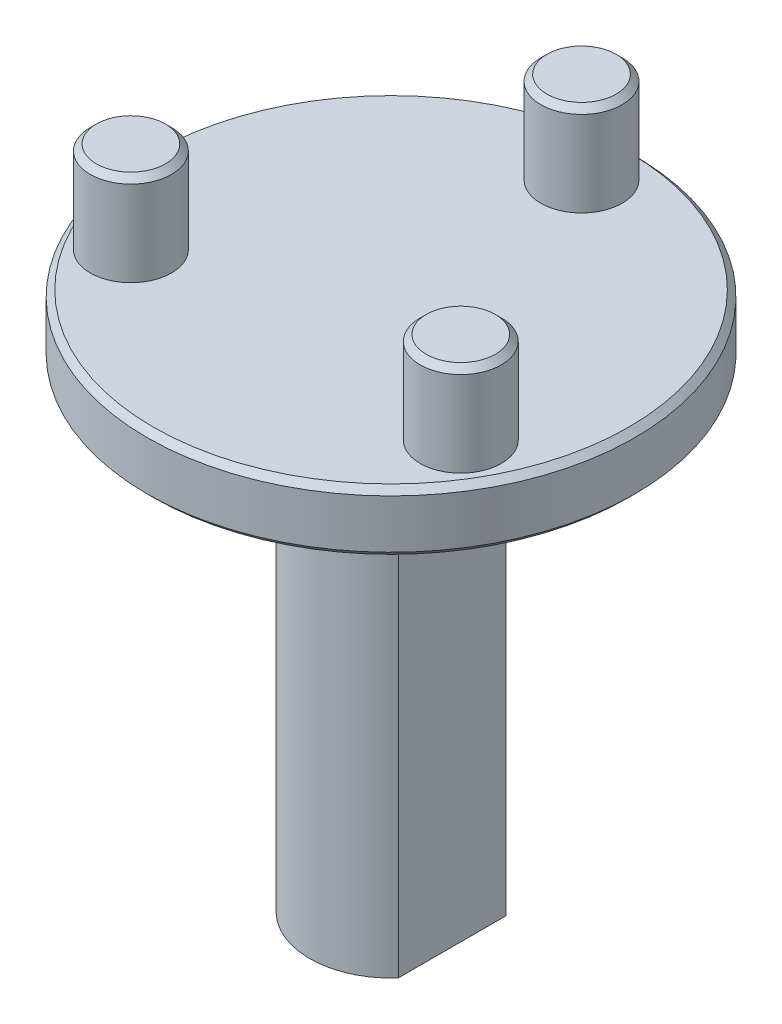
from build123d import *

# Parameters (mm, degrees)
SKETCH1_R           = 12
BOSS_EXTRUDE1_DEPTH = 3
SKETCH2_R           = 2
BOSS_EXTRUDE2_DEPTH = 4.5
SKETCH3_R           = 5
BOSS_EXTRUDE3_DEPTH = 1
BOSS_EXTRUDE4_DEPTH = 22.5
CHAMFER1_SIZE       = 0.3


with BuildPart() as part:
    # Sketch1 → Boss-Extrude1 (new body)
    with BuildSketch(Plane(origin=(0, 0, 0), x_dir=(1, 0, 0), z_dir=(0, 1, 0))):
        with Locations(Location((0, 0, 0), (0, 0, 270))):
            Circle(SKETCH1_R)
    extrude(amount=BOSS_EXTRUDE1_DEPTH)

    # Sketch2 → Boss-Extrude2 (add)
    with BuildSketch(Plane(origin=(0, 3, 0), x_dir=(1, 0, 0), z_dir=(0, 1, 0))):
        with Locations(Location((0, 9.37, 0), (0, 0, 270))):
            Circle(SKETCH2_R)
        with Locations(Location((-8.114658033, -4.685, 0), (0, 0, 270))):
            Circle(SKETCH2_R)
        with Locations(Location((8.114658033, -4.685, 0), (0, 0, 270))):
            Circle(SKETCH2_R)
    extrude(amount=BOSS_EXTRUDE2_DEPTH)

    # Sketch3 → Boss-Extrude3 (add)
    with BuildSketch(Plane.XZ):
        with Locations(Location((0, 0, 0), (0, 0, 270))):
            Circle(SKETCH3_R)
    extrude(amount=BOSS_EXTRUDE3_DEPTH)

    # Sketch4 → Boss-Extrude4 (add)
    with BuildSketch(Plane.XZ.offset(1)):
        with BuildLine():
            Line((3, 2.645751311), (3, -2.645751311))
            ThreePointArc((3, -2.645751311), (-4, 0), (3, 2.645751311))
        make_face()
    extrude(amount=BOSS_EXTRUDE4_DEPTH)

    # Chamfer1
    chamfer1_edges = [part.edges().sort_by_distance(p)[0] for p in [
        (-8.114658033, 7.5, 2.685),
        (8.114658033, 7.5, 2.685),
        (0, 0, -12),
        (0, 3, -12),
        (0, 7.5, -11.37),
    ]]
    chamfer(chamfer1_edges, length=CHAMFER1_SIZE)


solid = part.part
